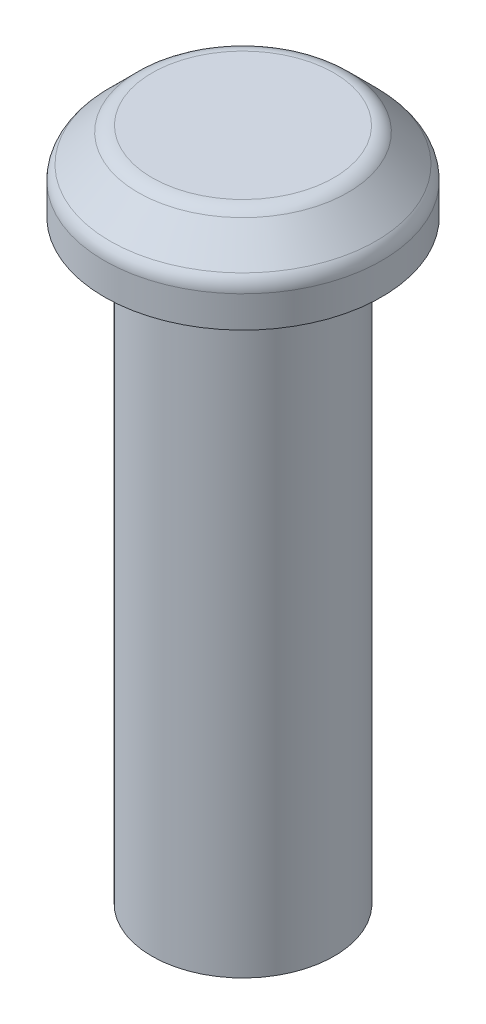
from build123d import *

# Parameters (mm, degrees)
SKETCH1_R           = 2.3
BOSS_EXTRUDE1_DEPTH = 15
SKETCH2_R           = 3.5
BOSS_EXTRUDE2_DEPTH = 2
CHAMFER1_SIZE       = 1
FILLET1_R           = 0.5


with BuildPart() as part:
    # Sketch1 → Boss-Extrude1 (new body)
    with BuildSketch(Plane(origin=(0, 0, 0), x_dir=(1, 0, 0), z_dir=(0, 1, 0))):
        with Locations(Location((0, 0, 0), (0, 0, 270))):
            Circle(SKETCH1_R)
    extrude(amount=BOSS_EXTRUDE1_DEPTH)

    # Sketch2 → Boss-Extrude2 (add)
    with BuildSketch(Plane(origin=(0, 15, 0), x_dir=(1, 0, 0), z_dir=(0, 1, 0))):
        with Locations(Location((0, 0, 0), (0, 0, 270))):
            Circle(SKETCH2_R)
    extrude(amount=BOSS_EXTRUDE2_DEPTH)

    # Chamfer1
    chamfer1_edges = [part.edges().sort_by_distance(p)[0] for p in [
        (0, 17, -3.5),
    ]]
    chamfer(chamfer1_edges, length=CHAMFER1_SIZE)

    # Fillet1
    fillet1_edges = [part.edges().sort_by_distance(p)[0] for p in [
        (0, 17, -2.5),
        (0, 16, -3.5),
    ]]
    fillet(fillet1_edges, radius=FILLET1_R)


solid = part.part
